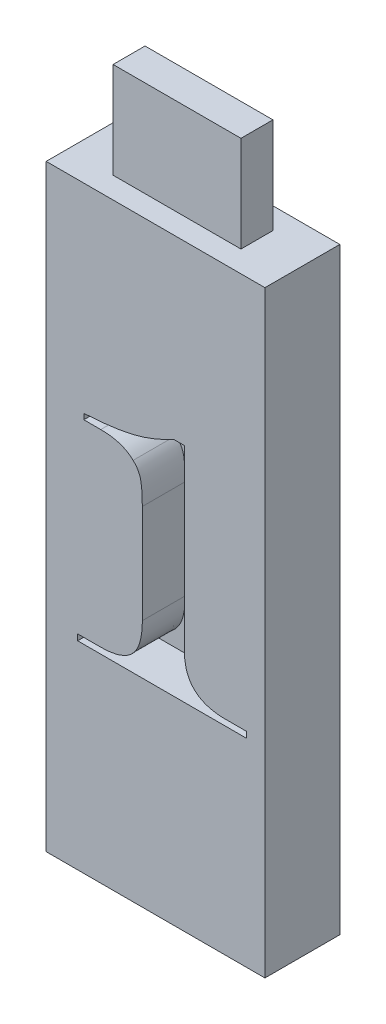
from build123d import *

# Parameters (mm, degrees)
SKETCH1_W           = 17.38
SKETCH1_H           = 47.498
BOSS_EXTRUDE1_DEPTH = 5.95
CUT_EXTRUDE1_DEPTH  = 3.41
SKETCH3_W           = 10.16
SKETCH3_H           = 2.54
BOSS_EXTRUDE2_DEPTH = 7.62


with BuildPart() as part:
    # Sketch1 → Boss-Extrude1 (new body)
    with BuildSketch(Plane.XY):
        Rectangle(SKETCH1_W, SKETCH1_H)
    extrude(amount=BOSS_EXTRUDE1_DEPTH)

    # Sketch2 → Cut-Extrude1 (cut)
    with BuildSketch(Plane.XY.offset(5.95)):
        with BuildLine():
            Line((-6.189150765, -7.510055771), (-4.375543678, -7.510055771))
            add(Edge.make_bspline(
                [(-4.375543678, -7.510055771), (-4.236100034, -7.508741028), (-3.965259686, -7.506187413), (-3.575157739, -7.462880983), (-3.212929647, -7.401011341), (-2.879952148, -7.312618696), (-2.576880198, -7.195940416), (-2.299787614, -7.059475133), (-2.057227298, -6.889398664), (-1.839886176, -6.696896273), (-1.6506173, -6.473748397), (-1.49147229, -6.216884478), (-1.351582714, -5.931396028), (-1.240365711, -5.611742151), (-1.156767721, -5.260026908), (-1.093019054, -4.878648158), (-1.055622823, -4.465737579), (-1.052313767, -4.18021236), (-1.050597351, -4.03210967)],
                knots=[0, 0, 0, 0, 1.200271823, 2.331279013, 3.375715191, 4.363218718, 5.292340221, 6.169095557, 7.016022317, 7.835399336, 8.663899785, 9.525803296, 10.431341886, 11.396986964, 12.433702812, 13.541488193, 14.724763392, 16, 16, 16, 16], degree=3))
            Line((-1.050597351, -4.03210967), (-1.050597351, 3.823122672))
            add(Edge.make_bspline(
                [(-1.050597351, 3.823122672), (-1.050990706, 4.018476815), (-1.051722861, 4.38209167), (-1.082819341, 4.883729691), (-1.123621868, 5.300544302), (-1.186312233, 5.642512462), (-1.277849339, 5.934194205), (-1.409859259, 6.190898998), (-1.576026296, 6.428387627), (-1.712615445, 6.564129267), (-1.782010909, 6.633094146)],
                knots=[0, 0, 0, 0, 1.563811524, 2.910739897, 4.022716534, 4.915381324, 5.690198038, 6.460778295, 7.217983238, 8, 8, 8, 8], degree=3))
            add(Edge.make_bspline(
                [(-1.782010909, 6.633094146), (-1.857869082, 6.699334544), (-2.010689546, 6.832779473), (-2.266570655, 7.006932331), (-2.552722511, 7.147733735), (-2.863765744, 7.261431627), (-3.198352588, 7.358338614), (-3.560509802, 7.416582757), (-3.947751905, 7.461850273), (-4.214926271, 7.464099814), (-4.353153467, 7.465263653)],
                knots=[0, 0, 0, 0, 0.872288361, 1.757272915, 2.673228345, 3.628310148, 4.624832827, 5.686398416, 6.803018934, 8, 8, 8, 8], degree=3))
            Line((-4.353153467, 7.465263653), (-5.700297825, 7.465263653))
            Line((-5.700297825, 7.465263653), (-5.700297825, 7.90933617))
            add(Edge.make_bspline(
                [(-5.700297825, 7.90933617), (-5.451430477, 7.922958599), (-4.966965958, 7.949477079), (-4.25899913, 8.010023738), (-3.589407964, 8.083563347), (-2.954434187, 8.172799954), (-2.352988403, 8.280285748), (-1.78214455, 8.408269267), (-1.238010952, 8.547978741), (-0.715430392, 8.715533332), (-0.195727602, 8.910375221), (0.33741676, 9.132306906), (0.886154119, 9.39705879), (1.256038344, 9.587742493), (1.44591117, 9.685626239)],
                knots=[0, 0, 0, 0, 1.206551741, 2.348767378, 3.4393851, 4.467302093, 5.452435193, 6.396265705, 7.29893257, 8.171177332, 9.051491902, 9.98535699, 10.965822455, 12, 12, 12, 12], degree=3))
            Line((1.44591117, 9.685626239), (2.293007484, 9.685626239))
            Line((2.293007484, 9.685626239), (2.293007484, -4.457523678))
            add(Edge.make_bspline(
                [(2.293007484, -4.457523678), (2.294317311, -4.580815267), (2.296865591, -4.820680062), (2.340584624, -5.167266406), (2.402324898, -5.491083353), (2.490852806, -5.790612798), (2.608465987, -6.064671603), (2.745851868, -6.318652921), (2.914467795, -6.54690087), (3.110897203, -6.749009464), (3.329168057, -6.930218955), (3.572808862, -7.08810542), (3.844565821, -7.217801947), (4.140194362, -7.32714774), (4.462230563, -7.407047666), (4.808870425, -7.466843235), (5.180494619, -7.504994367), (5.437493331, -7.508338715), (5.569441686, -7.510055771)],
                knots=[0, 0, 0, 0, 1.151629664, 2.240504938, 3.259800832, 4.230940235, 5.153094675, 6.043018888, 6.924394745, 7.796053501, 8.671426729, 9.571246426, 10.502083077, 11.480572872, 12.512719618, 13.598486478, 14.767014217, 16, 16, 16, 16], degree=3))
            Line((5.569441686, -7.510055771), (7.244975806, -7.510055771))
            Line((7.244975806, -7.510055771), (7.244975806, -7.987713605))
            Line((7.244975806, -7.987713605), (-6.189150765, -7.987713605))
            Line((-6.189150765, -7.987713605), (-6.189150765, -7.510055771))
        make_face()
    extrude(amount=-CUT_EXTRUDE1_DEPTH, mode=Mode.SUBTRACT)

    # Sketch3 → Boss-Extrude2 (add)
    with BuildSketch(Plane(origin=(0, 23.749, 0), x_dir=(1, 0, 0), z_dir=(0, 1, 0))):
        with Locations((0, -2.975)):
            Rectangle(SKETCH3_W, SKETCH3_H)
    extrude(amount=BOSS_EXTRUDE2_DEPTH)


solid = part.part
